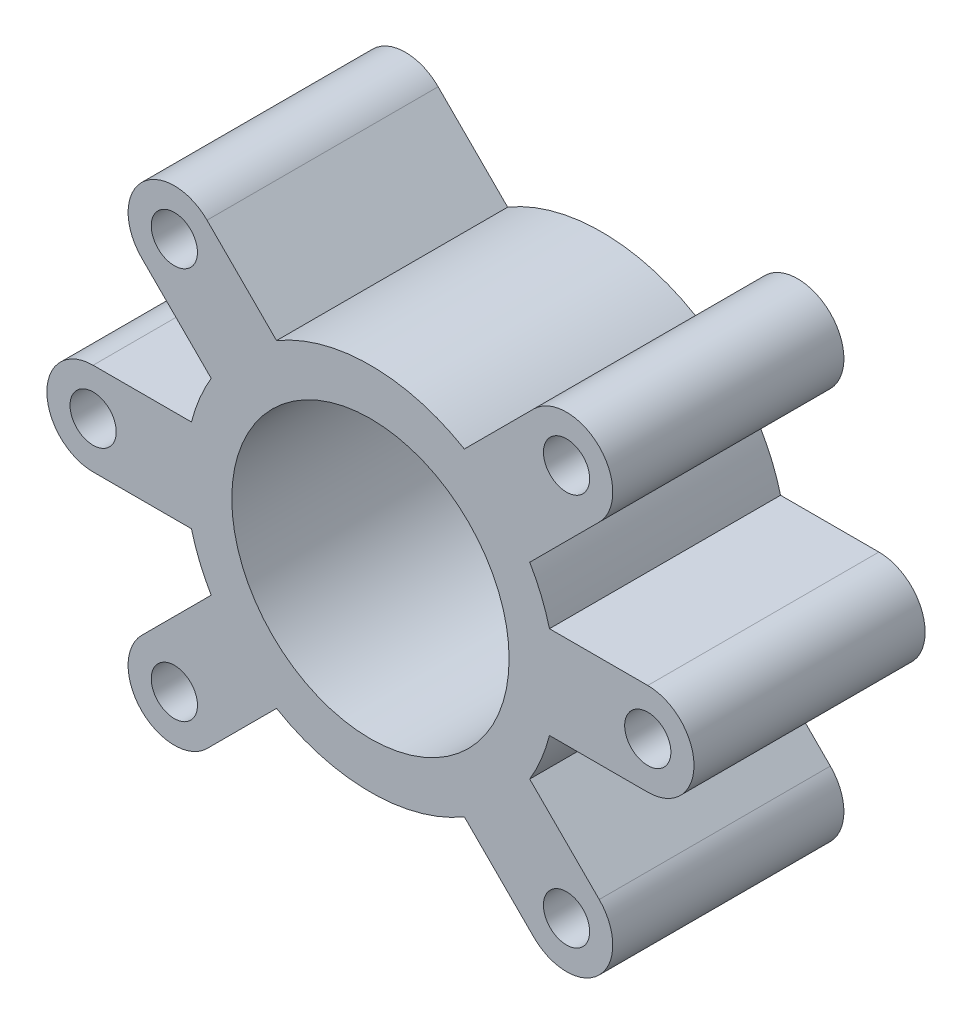
from build123d import *

# Parameters (mm, degrees)
SKETCH1_R           = 40
SKETCH1_R_2         = 30
SKETCH1_R_3         = 5
BOSS_EXTRUDE1_DEPTH = 50


with BuildPart() as part:
    # Sketch1 → Boss-Extrude1 (new body)
    # profile 1 of 7: a face of its own
    with BuildSketch(Plane.XY):
        Circle(SKETCH1_R)
        Circle(SKETCH1_R_2, mode=Mode.SUBTRACT)
    # profile 2 of 7: a face of its own
    with BuildSketch(Plane.XY):
        with BuildLine():
            ThreePointArc((-34.457195687, 20.315060063), (-28.284271247, 28.284271247), (-20.315060063, 34.457195687))
            Line((-20.315060063, 34.457195687), (-35.355339059, 49.497474683))
            ThreePointArc((-35.355339059, 49.497474683), (-49.497474683, 49.497474683), (-49.497474683, 35.355339059))
            Line((-49.497474683, 35.355339059), (-34.457195687, 20.315060063))
        make_face()
        with Locations((-42.426406871, 42.426406871)):
            Circle(SKETCH1_R_3, mode=Mode.SUBTRACT)
    # profile 3 of 7: a face of its own
    with BuildSketch(Plane.XY):
        with BuildLine():
            ThreePointArc((-38.729833462, -10), (-40, 0), (-38.729833462, 10))
            Line((-38.729833462, 10), (-60, 10))
            ThreePointArc((-60, 10), (-70, 0), (-60, -10))
            Line((-60, -10), (-38.729833462, -10))
        make_face()
        with Locations((-60, 0)):
            Circle(SKETCH1_R_3, mode=Mode.SUBTRACT)
    # profile 4 of 7: a face of its own
    with BuildSketch(Plane.XY):
        with BuildLine():
            Line((-35.355339059, -49.497474683), (-20.315060063, -34.457195687))
            ThreePointArc((-20.315060063, -34.457195687), (-28.284271247, -28.284271247), (-34.457195687, -20.315060063))
            Line((-34.457195687, -20.315060063), (-49.497474683, -35.355339059))
            ThreePointArc((-49.497474683, -35.355339059), (-49.497474683, -49.497474683), (-35.355339059, -49.497474683))
        make_face()
        with Locations((-42.426406871, -42.426406871)):
            Circle(SKETCH1_R_3, mode=Mode.SUBTRACT)
    # profile 5 of 7: a face of its own
    with BuildSketch(Plane.XY):
        with BuildLine():
            Line((49.497474683, -35.355339059), (34.457195687, -20.315060063))
            ThreePointArc((34.457195687, -20.315060063), (28.284271247, -28.284271247), (20.315060063, -34.457195687))
            Line((20.315060063, -34.457195687), (35.355339059, -49.497474683))
            ThreePointArc((35.355339059, -49.497474683), (49.497474683, -49.497474683), (49.497474683, -35.355339059))
        make_face()
        with Locations((42.426406871, -42.426406871)):
            Circle(SKETCH1_R_3, mode=Mode.SUBTRACT)
    # profile 6 of 7: a face of its own
    with BuildSketch(Plane.XY):
        with BuildLine():
            Line((60, 10), (38.729833462, 10))
            ThreePointArc((38.729833462, 10), (39.681187851, 5.040171699), (40, 0))
            ThreePointArc((40, 0), (39.681187851, -5.040171699), (38.729833462, -10))
            Line((38.729833462, -10), (60, -10))
            ThreePointArc((60, -10), (70, 0), (60, 10))
        make_face()
        with Locations((60, 0)):
            Circle(SKETCH1_R_3, mode=Mode.SUBTRACT)
    # profile 7 of 7: a face of its own
    with BuildSketch(Plane.XY):
        with BuildLine():
            ThreePointArc((20.315060063, 34.457195687), (28.284271247, 28.284271247), (34.457195687, 20.315060063))
            Line((34.457195687, 20.315060063), (49.497474683, 35.355339059))
            ThreePointArc((49.497474683, 35.355339059), (49.497474683, 49.497474683), (35.355339059, 49.497474683))
            Line((35.355339059, 49.497474683), (20.315060063, 34.457195687))
        make_face()
        with Locations((42.426406871, 42.426406871)):
            Circle(SKETCH1_R_3, mode=Mode.SUBTRACT)
    extrude(amount=BOSS_EXTRUDE1_DEPTH)


solid = part.part
